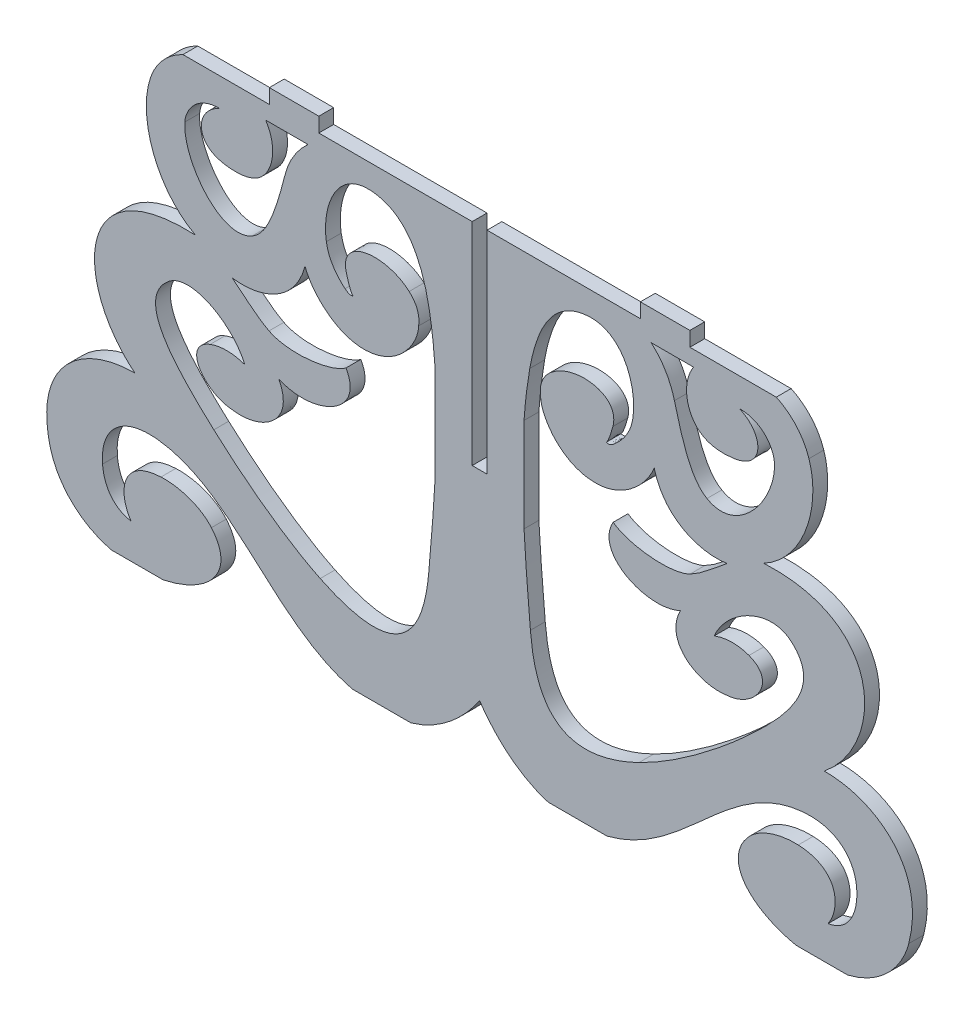
from build123d import *

# Parameters (mm, degrees)
RESSALTO_EXTRUS_O1_DEPTH = 2


with BuildPart() as part:
    # Model → Ressalto-extrusão1 (new body)
    with BuildSketch(Plane.XY):
        with BuildLine():
            Line((39.01, -72.758), (45.9466, -72.758))
            add(Edge.make_bspline(
                [(45.9466, -72.758), (50.593, -71.6353), (53.3599, -68.2207), (54.1991, -64.9676)],
                knots=[0.166666667, 0.166666667, 0.166666667, 0.166666667, 0.19047619, 0.19047619, 0.19047619, 0.19047619], degree=3))
            add(Edge.make_bspline(
                [(54.1991, -64.9676), (56.5947, -55.6799), (50.0219, -50.4817), (42.8047, -50.5322)],
                knots=[0.19047619, 0.19047619, 0.19047619, 0.19047619, 0.214285714, 0.214285714, 0.214285714, 0.214285714], degree=3))
            add(Edge.make_bspline(
                [(42.8047, -50.5322), (51.071, -43.9022), (51.1176, -29.5576), (34.6597, -30.3526)],
                knots=[0.214285714, 0.214285714, 0.214285714, 0.214285714, 0.238095238, 0.238095238, 0.238095238, 0.238095238], degree=3))
            add(Edge.make_bspline(
                [(34.6597, -30.3526), (39.9859, -27.4897), (42.4387, -20.2826), (40.748, -15.0992)],
                knots=[0.238095238, 0.238095238, 0.238095238, 0.238095238, 0.261904762, 0.261904762, 0.261904762, 0.261904762], degree=3))
            add(Edge.make_bspline(
                [(40.748, -15.0992), (40.1089, -13.1398), (38.6749, -11.2333), (36.3446, -10.1245)],
                knots=[0.261904762, 0.261904762, 0.261904762, 0.261904762, 0.285714286, 0.285714286, 0.285714286, 0.285714286], degree=3))
            Line((36.3446, -10.1245), (24.701, -10.1245))
            Line((24.701, -10.1245), (24.701, -8.1567))
            Line((24.701, -8.1567), (18.0344, -8.1567))
            Line((18.0344, -8.1567), (18.0344, -10.1245))
            Line((18.0344, -10.1245), (-2.6323, -10.1245))
            Line((-2.6323, -10.1245), (-2.6323, -38.5956))
            Line((-2.6323, -38.5956), (-4.6323, -38.5956))
            Line((-4.6323, -38.5956), (-4.6323, -10.1245))
            Line((-4.6323, -10.1245), (-25.299, -10.1245))
            Line((-25.299, -10.1245), (-25.299, -8.1567))
            Line((-25.299, -8.1567), (-31.9656, -8.1567))
            Line((-31.9656, -8.1567), (-31.9656, -10.1245))
            Line((-31.9656, -10.1245), (-43.6092, -10.1245))
            add(Edge.make_bspline(
                [(-43.6092, -10.1245), (-45.9395, -11.2333), (-47.3735, -13.1398), (-48.0126, -15.0992)],
                knots=[0.595238095, 0.595238095, 0.595238095, 0.595238095, 0.619047619, 0.619047619, 0.619047619, 0.619047619], degree=3))
            add(Edge.make_bspline(
                [(-48.0126, -15.0992), (-49.7033, -20.2826), (-47.2505, -27.4897), (-41.9243, -30.3526)],
                knots=[0.619047619, 0.619047619, 0.619047619, 0.619047619, 0.642857143, 0.642857143, 0.642857143, 0.642857143], degree=3))
            add(Edge.make_bspline(
                [(-41.9243, -30.3526), (-58.3822, -29.5576), (-58.3356, -43.9022), (-50.0693, -50.5322)],
                knots=[0.642857143, 0.642857143, 0.642857143, 0.642857143, 0.666666667, 0.666666667, 0.666666667, 0.666666667], degree=3))
            add(Edge.make_bspline(
                [(-50.0693, -50.5322), (-57.2865, -50.4817), (-63.8593, -55.6799), (-61.4637, -64.9676)],
                knots=[0.666666667, 0.666666667, 0.666666667, 0.666666667, 0.69047619, 0.69047619, 0.69047619, 0.69047619], degree=3))
            add(Edge.make_bspline(
                [(-61.4637, -64.9676), (-60.6245, -68.2207), (-57.8576, -71.6353), (-53.2112, -72.758)],
                knots=[0.69047619, 0.69047619, 0.69047619, 0.69047619, 0.714285714, 0.714285714, 0.714285714, 0.714285714], degree=3))
            Line((-53.2112, -72.758), (-46.2746, -72.758))
            add(Edge.make_bspline(
                [(-46.2746, -72.758), (-40.2399, -71.5011), (-36.3321, -67.4468), (-39.7729, -63.4191)],
                knots=[0.738095238, 0.738095238, 0.738095238, 0.738095238, 0.761904762, 0.761904762, 0.761904762, 0.761904762], degree=3))
            add(Edge.make_bspline(
                [(-39.7729, -63.4191), (-41.2514, -61.6884), (-44.063, -60.7864), (-46.5699, -60.9035)],
                knots=[0.761904762, 0.761904762, 0.761904762, 0.761904762, 0.785714286, 0.785714286, 0.785714286, 0.785714286], degree=3))
            add(Edge.make_bspline(
                [(-46.5699, -60.9035), (-52.0375, -61.1589), (-52.3556, -65.4896), (-50.5901, -68.072)],
                knots=[0.785714286, 0.785714286, 0.785714286, 0.785714286, 0.80952381, 0.80952381, 0.80952381, 0.80952381], degree=3))
            add(Edge.make_bspline(
                [(-50.5901, -68.072), (-53.1626, -67.632), (-54.2639, -65.5144), (-54.4438, -63.3321)],
                knots=[0.80952381, 0.80952381, 0.80952381, 0.80952381, 0.833333333, 0.833333333, 0.833333333, 0.833333333], degree=3))
            add(Edge.make_bspline(
                [(-54.4438, -63.3321), (-54.7772, -59.2874), (-52.1108, -56.229), (-47.0493, -56.7452)],
                knots=[0.833333333, 0.833333333, 0.833333333, 0.833333333, 0.857142857, 0.857142857, 0.857142857, 0.857142857], degree=3))
            add(Edge.make_bspline(
                [(-47.0493, -56.7452), (-36.8554, -57.7851), (-31.3645, -70.0782), (-20.7922, -72.758)],
                knots=[0.857142857, 0.857142857, 0.857142857, 0.857142857, 0.880952381, 0.880952381, 0.880952381, 0.880952381], degree=3))
            Line((-20.7922, -72.758), (-12.8827, -72.758))
            add(Edge.make_bspline(
                [(-12.8827, -72.758), (-7.3612, -71.1534), (-4.1128, -66.2698), (-3.6323, -65.5117)],
                knots=[0.904761905, 0.904761905, 0.904761905, 0.904761905, 0.928571429, 0.928571429, 0.928571429, 0.928571429], degree=3))
            add(Edge.make_bspline(
                [(-3.6323, -65.5117), (-3.1518, -66.2698), (0.0966, -71.1534), (5.6181, -72.758)],
                knots=[0.928571429, 0.928571429, 0.928571429, 0.928571429, 0.952380952, 0.952380952, 0.952380952, 0.952380952], degree=3))
            Line((5.6181, -72.758), (13.5276, -72.758))
            add(Edge.make_bspline(
                [(13.5276, -72.758), (24.0999, -70.0782), (29.5908, -57.7851), (39.7847, -56.7452)],
                knots=[0, 0, 0, 0, 0.023809524, 0.023809524, 0.023809524, 0.023809524], degree=3))
            add(Edge.make_bspline(
                [(39.7847, -56.7452), (44.8462, -56.229), (47.5126, -59.2874), (47.1792, -63.3321)],
                knots=[0.023809524, 0.023809524, 0.023809524, 0.023809524, 0.047619048, 0.047619048, 0.047619048, 0.047619048], degree=3))
            add(Edge.make_bspline(
                [(47.1792, -63.3321), (46.9993, -65.5144), (45.898, -67.632), (43.3255, -68.072)],
                knots=[0.047619048, 0.047619048, 0.047619048, 0.047619048, 0.071428571, 0.071428571, 0.071428571, 0.071428571], degree=3))
            add(Edge.make_bspline(
                [(43.3255, -68.072), (45.091, -65.4896), (44.7729, -61.1589), (39.3053, -60.9035)],
                knots=[0.071428571, 0.071428571, 0.071428571, 0.071428571, 0.095238095, 0.095238095, 0.095238095, 0.095238095], degree=3))
            add(Edge.make_bspline(
                [(39.3053, -60.9035), (36.7984, -60.7864), (33.9868, -61.6884), (32.5083, -63.4191)],
                knots=[0.095238095, 0.095238095, 0.095238095, 0.095238095, 0.119047619, 0.119047619, 0.119047619, 0.119047619], degree=3))
            add(Edge.make_bspline(
                [(32.5083, -63.4191), (29.0675, -67.4468), (32.9753, -71.5011), (39.01, -72.758)],
                knots=[0.119047619, 0.119047619, 0.119047619, 0.119047619, 0.142857143, 0.142857143, 0.142857143, 0.142857143], degree=3))
        make_face()
        with BuildLine():
            Line((-26.7511, -12.1942), (-32.4569, -12.1942))
            add(Edge.make_bspline(
                [(-32.4569, -12.1942), (-31.1733, -14.1768), (-31.2313, -16.7106), (-32.4844, -18.471)],
                knots=[0, 0, 0, 0, 0.111111111, 0.111111111, 0.111111111, 0.111111111], degree=3))
            add(Edge.make_bspline(
                [(-32.4844, -18.471), (-33.3768, -19.7246), (-35.0403, -20.5546), (-37.9276, -20.132)],
                knots=[0.111111111, 0.111111111, 0.111111111, 0.111111111, 0.222222222, 0.222222222, 0.222222222, 0.222222222], degree=3))
            add(Edge.make_bspline(
                [(-37.9276, -20.132), (-42.1519, -19.5136), (-41.9903, -15.4117), (-38.6474, -13.942)],
                knots=[0.222222222, 0.222222222, 0.222222222, 0.222222222, 0.333333333, 0.333333333, 0.333333333, 0.333333333], degree=3))
            add(Edge.make_bspline(
                [(-38.6474, -13.942), (-41.6734, -13.9053), (-43.2427, -16.2203), (-43.3562, -17.8679)],
                knots=[0.333333333, 0.333333333, 0.333333333, 0.333333333, 0.444444444, 0.444444444, 0.444444444, 0.444444444], degree=3))
            add(Edge.make_bspline(
                [(-43.3562, -17.8679), (-43.6636, -22.3248), (-38.5123, -29.0887), (-34.2704, -26.6235)],
                knots=[0.444444444, 0.444444444, 0.444444444, 0.444444444, 0.555555556, 0.555555556, 0.555555556, 0.555555556], degree=3))
            add(Edge.make_bspline(
                [(-34.2704, -26.6235), (-32.5007, -25.5951), (-31.3381, -23.1377), (-29.8837, -17.3969)],
                knots=[0.555555556, 0.555555556, 0.555555556, 0.555555556, 0.666666667, 0.666666667, 0.666666667, 0.666666667], degree=3))
            add(Edge.make_bspline(
                [(-29.8837, -17.3969), (-29.3667, -15.3561), (-28.3138, -13.5718), (-26.7511, -12.1942)],
                knots=[0.666666667, 0.666666667, 0.666666667, 0.666666667, 0.777777778, 0.777777778, 0.777777778, 0.777777778], degree=3))
        make_face(mode=Mode.SUBTRACT)
        with BuildLine():
            Line((-9.6217, -42.4913), (-9.6217, -29.8374))
            add(Edge.make_bspline(
                [(-9.6217, -29.8374), (-9.7726, -27.6467), (-10.0208, -25.4894), (-10.3939, -23.383)],
                knots=[0.041666667, 0.041666667, 0.041666667, 0.041666667, 0.083333333, 0.083333333, 0.083333333, 0.083333333], degree=3))
            add(Edge.make_bspline(
                [(-10.3939, -23.383), (-11.331, -18.092), (-13.5268, -13.6157), (-18.2928, -13.3357)],
                knots=[0.083333333, 0.083333333, 0.083333333, 0.083333333, 0.125, 0.125, 0.125, 0.125], degree=3))
            add(Edge.make_bspline(
                [(-18.2928, -13.3357), (-23.0171, -13.0581), (-24.9083, -18.4091), (-24.2808, -22.2969)],
                knots=[0.125, 0.125, 0.125, 0.125, 0.166666667, 0.166666667, 0.166666667, 0.166666667], degree=3))
            add(Edge.make_bspline(
                [(-24.2808, -22.2969), (-24.0259, -23.8763), (-23.2335, -25.2779), (-21.7588, -26.5225)],
                knots=[0.166666667, 0.166666667, 0.166666667, 0.166666667, 0.208333333, 0.208333333, 0.208333333, 0.208333333], degree=3))
            add(Edge.make_bspline(
                [(-21.7588, -26.5225), (-21.3405, -26.8755), (-20.9898, -26.9691), (-20.7021, -26.8374)],
                knots=[0.208333333, 0.208333333, 0.208333333, 0.208333333, 0.25, 0.25, 0.25, 0.25], degree=3))
            add(Edge.make_bspline(
                [(-20.7021, -26.8374), (-20.8973, -26.6785), (-21.1963, -26.0369), (-21.5905, -24.5651)],
                knots=[0.25, 0.25, 0.25, 0.25, 0.291666667, 0.291666667, 0.291666667, 0.291666667], degree=3))
            add(Edge.make_bspline(
                [(-21.5905, -24.5651), (-22.6756, -20.5145), (-16.2984, -19.7002), (-13.1252, -22.5274)],
                knots=[0.291666667, 0.291666667, 0.291666667, 0.291666667, 0.333333333, 0.333333333, 0.333333333, 0.333333333], degree=3))
            add(Edge.make_bspline(
                [(-13.1252, -22.5274), (-12.1537, -23.3931), (-11.6464, -24.5495), (-11.8511, -25.9186)],
                knots=[0.333333333, 0.333333333, 0.333333333, 0.333333333, 0.375, 0.375, 0.375, 0.375], degree=3))
            add(Edge.make_bspline(
                [(-11.8511, -25.9186), (-11.9194, -28.4357), (-15.0834, -32.8113), (-20.0254, -32.2725)],
                knots=[0.375, 0.375, 0.375, 0.375, 0.416666667, 0.416666667, 0.416666667, 0.416666667], degree=3))
            add(Edge.make_bspline(
                [(-20.0254, -32.2725), (-23.5148, -31.8921), (-26.3139, -28.9039), (-27.1557, -26.6085)],
                knots=[0.416666667, 0.416666667, 0.416666667, 0.416666667, 0.458333333, 0.458333333, 0.458333333, 0.458333333], degree=3))
            add(Edge.make_bspline(
                [(-27.1557, -26.6085), (-28.5683, -31.8996), (-33.5101, -33.4082), (-36.9867, -32.8513)],
                knots=[0.458333333, 0.458333333, 0.458333333, 0.458333333, 0.5, 0.5, 0.5, 0.5], degree=3))
            add(Edge.make_bspline(
                [(-36.9867, -32.8513), (-35.3064, -34.1608), (-33.7715, -35.6527), (-32.007, -36.5689)],
                knots=[0.5, 0.5, 0.5, 0.5, 0.541666667, 0.541666667, 0.541666667, 0.541666667], degree=3))
            add(Edge.make_bspline(
                [(-32.007, -36.5689), (-29.3781, -37.934), (-23.7227, -37.273), (-21.6381, -35.709)],
                knots=[0.541666667, 0.541666667, 0.541666667, 0.541666667, 0.583333333, 0.583333333, 0.583333333, 0.583333333], degree=3))
            add(Edge.make_bspline(
                [(-21.6381, -35.709), (-18.9894, -40.335), (-26.1931, -43.6202), (-30.699, -41.5005)],
                knots=[0.583333333, 0.583333333, 0.583333333, 0.583333333, 0.625, 0.625, 0.625, 0.625], degree=3))
            add(Edge.make_bspline(
                [(-30.699, -41.5005), (-28.4119, -45.8308), (-32.9424, -48.9432), (-37.1074, -48.2288)],
                knots=[0.625, 0.625, 0.625, 0.625, 0.666666667, 0.666666667, 0.666666667, 0.666666667], degree=3))
            add(Edge.make_bspline(
                [(-37.1074, -48.2288), (-40.7542, -47.9131), (-43.8613, -43.6198), (-39.9339, -42.1042)],
                knots=[0.666666667, 0.666666667, 0.666666667, 0.666666667, 0.708333333, 0.708333333, 0.708333333, 0.708333333], degree=3))
            add(Edge.make_bspline(
                [(-39.9339, -42.1042), (-38.6761, -41.6188), (-36.9586, -41.5293), (-35.2485, -42.1605)],
                knots=[0.708333333, 0.708333333, 0.708333333, 0.708333333, 0.75, 0.75, 0.75, 0.75], degree=3))
            add(Edge.make_bspline(
                [(-35.2485, -42.1605), (-36.9784, -38.1517), (-42.6099, -35.182), (-45.5096, -37.5422)],
                knots=[0.75, 0.75, 0.75, 0.75, 0.791666667, 0.791666667, 0.791666667, 0.791666667], degree=3))
            add(Edge.make_bspline(
                [(-45.5096, -37.5422), (-50.1258, -41.2994), (-44.9673, -46.8017), (-39.4446, -51.8319)],
                knots=[0.791666667, 0.791666667, 0.791666667, 0.791666667, 0.833333333, 0.833333333, 0.833333333, 0.833333333], degree=3))
            add(Edge.make_bspline(
                [(-39.4446, -51.8319), (-36.6658, -54.3629), (-30.845, -59.2324), (-25.1107, -62.0186)],
                knots=[0.833333333, 0.833333333, 0.833333333, 0.833333333, 0.875, 0.875, 0.875, 0.875], degree=3))
            add(Edge.make_bspline(
                [(-25.1107, -62.0186), (-13.1524, -67.8289), (-10.9954, -59.9068), (-10.4758, -53.8978)],
                knots=[0.875, 0.875, 0.875, 0.875, 0.916666667, 0.916666667, 0.916666667, 0.916666667], degree=3))
            add(Edge.make_bspline(
                [(-10.4758, -53.8978), (-10.1517, -50.1504), (-9.8219, -46.3199), (-9.6217, -42.4913)],
                knots=[0.916666667, 0.916666667, 0.916666667, 0.916666667, 1, 1, 1, 1], degree=3))
        make_face(mode=Mode.SUBTRACT)
        with BuildLine():
            Line((19.4865, -12.1942), (25.1923, -12.1942))
            add(Edge.make_bspline(
                [(25.1923, -12.1942), (23.9087, -14.1768), (23.9667, -16.7106), (25.2198, -18.471)],
                knots=[0, 0, 0, 0, 0.111111111, 0.111111111, 0.111111111, 0.111111111], degree=3))
            add(Edge.make_bspline(
                [(25.2198, -18.471), (26.1122, -19.7246), (27.7757, -20.5546), (30.663, -20.132)],
                knots=[0.111111111, 0.111111111, 0.111111111, 0.111111111, 0.222222222, 0.222222222, 0.222222222, 0.222222222], degree=3))
            add(Edge.make_bspline(
                [(30.663, -20.132), (34.8873, -19.5136), (34.7257, -15.4117), (31.3828, -13.942)],
                knots=[0.222222222, 0.222222222, 0.222222222, 0.222222222, 0.333333333, 0.333333333, 0.333333333, 0.333333333], degree=3))
            add(Edge.make_bspline(
                [(31.3828, -13.942), (34.4088, -13.9053), (35.9781, -16.2203), (36.0916, -17.8679)],
                knots=[0.333333333, 0.333333333, 0.333333333, 0.333333333, 0.444444444, 0.444444444, 0.444444444, 0.444444444], degree=3))
            add(Edge.make_bspline(
                [(36.0916, -17.8679), (36.399, -22.3248), (31.2477, -29.0887), (27.0058, -26.6235)],
                knots=[0.444444444, 0.444444444, 0.444444444, 0.444444444, 0.555555556, 0.555555556, 0.555555556, 0.555555556], degree=3))
            add(Edge.make_bspline(
                [(27.0058, -26.6235), (25.2361, -25.5951), (24.0735, -23.1377), (22.6191, -17.3969)],
                knots=[0.555555556, 0.555555556, 0.555555556, 0.555555556, 0.666666667, 0.666666667, 0.666666667, 0.666666667], degree=3))
            add(Edge.make_bspline(
                [(22.6191, -17.3969), (22.1021, -15.3561), (21.0492, -13.5718), (19.4865, -12.1942)],
                knots=[0.666666667, 0.666666667, 0.666666667, 0.666666667, 0.777777778, 0.777777778, 0.777777778, 0.777777778], degree=3))
        make_face(mode=Mode.SUBTRACT)
        with BuildLine():
            Line((2.3571, -42.4913), (2.3571, -29.8374))
            add(Edge.make_bspline(
                [(2.3571, -29.8374), (2.508, -27.6467), (2.7562, -25.4894), (3.1293, -23.383)],
                knots=[0.041666667, 0.041666667, 0.041666667, 0.041666667, 0.083333333, 0.083333333, 0.083333333, 0.083333333], degree=3))
            add(Edge.make_bspline(
                [(3.1293, -23.383), (4.0664, -18.092), (6.2622, -13.6157), (11.0282, -13.3357)],
                knots=[0.083333333, 0.083333333, 0.083333333, 0.083333333, 0.125, 0.125, 0.125, 0.125], degree=3))
            add(Edge.make_bspline(
                [(11.0282, -13.3357), (15.7525, -13.0581), (17.6437, -18.4091), (17.0162, -22.2969)],
                knots=[0.125, 0.125, 0.125, 0.125, 0.166666667, 0.166666667, 0.166666667, 0.166666667], degree=3))
            add(Edge.make_bspline(
                [(17.0162, -22.2969), (16.7613, -23.8763), (15.9689, -25.2779), (14.4942, -26.5225)],
                knots=[0.166666667, 0.166666667, 0.166666667, 0.166666667, 0.208333333, 0.208333333, 0.208333333, 0.208333333], degree=3))
            add(Edge.make_bspline(
                [(14.4942, -26.5225), (14.0759, -26.8755), (13.7252, -26.9691), (13.4375, -26.8374)],
                knots=[0.208333333, 0.208333333, 0.208333333, 0.208333333, 0.25, 0.25, 0.25, 0.25], degree=3))
            add(Edge.make_bspline(
                [(13.4375, -26.8374), (13.6327, -26.6785), (13.9317, -26.0369), (14.3259, -24.5651)],
                knots=[0.25, 0.25, 0.25, 0.25, 0.291666667, 0.291666667, 0.291666667, 0.291666667], degree=3))
            add(Edge.make_bspline(
                [(14.3259, -24.5651), (15.411, -20.5145), (9.0338, -19.7002), (5.8606, -22.5274)],
                knots=[0.291666667, 0.291666667, 0.291666667, 0.291666667, 0.333333333, 0.333333333, 0.333333333, 0.333333333], degree=3))
            add(Edge.make_bspline(
                [(5.8606, -22.5274), (4.8891, -23.3931), (4.3818, -24.5495), (4.5865, -25.9186)],
                knots=[0.333333333, 0.333333333, 0.333333333, 0.333333333, 0.375, 0.375, 0.375, 0.375], degree=3))
            add(Edge.make_bspline(
                [(4.5865, -25.9186), (4.6548, -28.4357), (7.8188, -32.8113), (12.7608, -32.2725)],
                knots=[0.375, 0.375, 0.375, 0.375, 0.416666667, 0.416666667, 0.416666667, 0.416666667], degree=3))
            add(Edge.make_bspline(
                [(12.7608, -32.2725), (16.2502, -31.8921), (19.0493, -28.9039), (19.8911, -26.6085)],
                knots=[0.416666667, 0.416666667, 0.416666667, 0.416666667, 0.458333333, 0.458333333, 0.458333333, 0.458333333], degree=3))
            add(Edge.make_bspline(
                [(19.8911, -26.6085), (21.3037, -31.8996), (26.2455, -33.4082), (29.7221, -32.8513)],
                knots=[0.458333333, 0.458333333, 0.458333333, 0.458333333, 0.5, 0.5, 0.5, 0.5], degree=3))
            add(Edge.make_bspline(
                [(29.7221, -32.8513), (28.0418, -34.1608), (26.5069, -35.6527), (24.7424, -36.5689)],
                knots=[0.5, 0.5, 0.5, 0.5, 0.541666667, 0.541666667, 0.541666667, 0.541666667], degree=3))
            add(Edge.make_bspline(
                [(24.7424, -36.5689), (22.1135, -37.934), (16.4581, -37.273), (14.3735, -35.709)],
                knots=[0.541666667, 0.541666667, 0.541666667, 0.541666667, 0.583333333, 0.583333333, 0.583333333, 0.583333333], degree=3))
            add(Edge.make_bspline(
                [(14.3735, -35.709), (11.7248, -40.335), (18.9285, -43.6202), (23.4344, -41.5005)],
                knots=[0.583333333, 0.583333333, 0.583333333, 0.583333333, 0.625, 0.625, 0.625, 0.625], degree=3))
            add(Edge.make_bspline(
                [(23.4344, -41.5005), (21.1473, -45.8308), (25.6778, -48.9432), (29.8428, -48.2288)],
                knots=[0.625, 0.625, 0.625, 0.625, 0.666666667, 0.666666667, 0.666666667, 0.666666667], degree=3))
            add(Edge.make_bspline(
                [(29.8428, -48.2288), (33.4896, -47.9131), (36.5967, -43.6198), (32.6693, -42.1042)],
                knots=[0.666666667, 0.666666667, 0.666666667, 0.666666667, 0.708333333, 0.708333333, 0.708333333, 0.708333333], degree=3))
            add(Edge.make_bspline(
                [(32.6693, -42.1042), (31.4115, -41.6188), (29.694, -41.5293), (27.9839, -42.1605)],
                knots=[0.708333333, 0.708333333, 0.708333333, 0.708333333, 0.75, 0.75, 0.75, 0.75], degree=3))
            add(Edge.make_bspline(
                [(27.9839, -42.1605), (29.7138, -38.1517), (35.3453, -35.182), (38.245, -37.5422)],
                knots=[0.75, 0.75, 0.75, 0.75, 0.791666667, 0.791666667, 0.791666667, 0.791666667], degree=3))
            add(Edge.make_bspline(
                [(38.245, -37.5422), (42.8612, -41.2994), (37.7027, -46.8017), (32.18, -51.8319)],
                knots=[0.791666667, 0.791666667, 0.791666667, 0.791666667, 0.833333333, 0.833333333, 0.833333333, 0.833333333], degree=3))
            add(Edge.make_bspline(
                [(32.18, -51.8319), (29.4012, -54.3629), (23.5804, -59.2324), (17.8461, -62.0186)],
                knots=[0.833333333, 0.833333333, 0.833333333, 0.833333333, 0.875, 0.875, 0.875, 0.875], degree=3))
            add(Edge.make_bspline(
                [(17.8461, -62.0186), (5.8878, -67.8289), (3.7308, -59.9068), (3.2112, -53.8978)],
                knots=[0.875, 0.875, 0.875, 0.875, 0.916666667, 0.916666667, 0.916666667, 0.916666667], degree=3))
            add(Edge.make_bspline(
                [(3.2112, -53.8978), (2.8871, -50.1504), (2.5573, -46.3199), (2.3571, -42.4913)],
                knots=[0.916666667, 0.916666667, 0.916666667, 0.916666667, 1, 1, 1, 1], degree=3))
        make_face(mode=Mode.SUBTRACT)
    extrude(amount=RESSALTO_EXTRUS_O1_DEPTH)


solid = part.part
